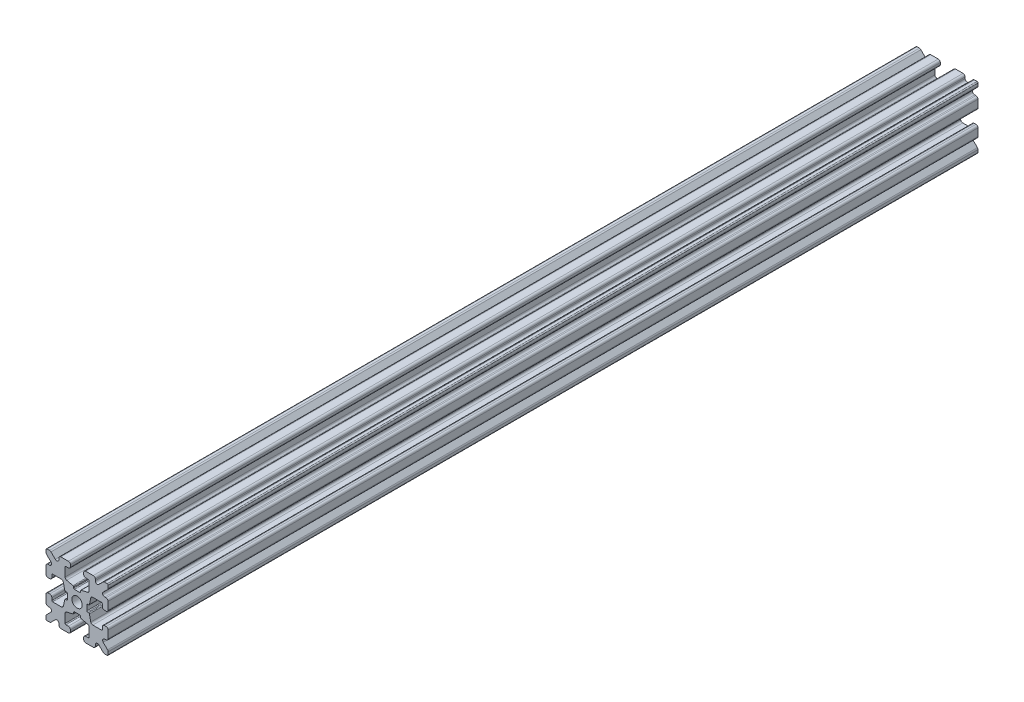
from build123d import *

# Parameters (mm, degrees)
SKETCH1_R           = 1.25
BOSS_EXTRUDE1_DEPTH = 210


with BuildPart() as part:
    # Sketch1 → Boss-Extrude1 (new body)
    with BuildSketch(Plane.XY.offset(150)):
        with BuildLine():
            Line((0.981757709, -2.970049142), (2.509355729, -3.312441801))
            ThreePointArc((2.509355729, -3.312441801), (2.790306204, -3.487828881), (2.900000001, -3.80033659))
            Line((2.900000001, -3.80033659), (2.900000001, -5.9))
            ThreePointArc((2.900000001, -5.9), (2.841421357, -6.041421356), (2.700000001, -6.1))
            Line((2.700000001, -6.1), (2.1, -6.1))
            ThreePointArc((2.1, -6.1), (1.746446609, -6.246446609), (1.6, -6.6))
            Line((1.6, -6.6), (1.6, -7))
            ThreePointArc((1.6, -7), (1.746446609, -7.353553391), (2.1, -7.5))
            Line((2.1, -7.5), (3.9, -7.5))
            ThreePointArc((3.9, -7.5), (4.253553391, -7.353553391), (4.4, -7))
            Line((4.4, -7), (4.4, -6.667766953))
            ThreePointArc((4.4, -6.667766953), (4.708658284, -6.205827187), (5.253553391, -6.314213563))
            Line((5.253553391, -6.314213563), (6.292893218, -7.353553391))
            ThreePointArc((6.292893218, -7.353553391), (6.455104893, -7.461939766), (6.646446609, -7.5))
            Line((6.646446609, -7.5), (7.25, -7.5))
            ThreePointArc((7.25, -7.5), (7.426776695, -7.426776695), (7.5, -7.25))
            Line((7.5, -7.25), (7.5, -6.646446609))
            ThreePointArc((7.5, -6.646446609), (7.461939766, -6.455104893), (7.353553391, -6.292893218))
            Line((7.353553391, -6.292893218), (6.314213563, -5.253553391))
            ThreePointArc((6.314213563, -5.253553391), (6.205827187, -4.708658284), (6.667766953, -4.4))
            Line((6.667766953, -4.4), (7, -4.4))
            ThreePointArc((7, -4.4), (7.353553391, -4.253553391), (7.5, -3.9))
            Line((7.5, -3.9), (7.5, -2.1))
            ThreePointArc((7.5, -2.1), (7.353553391, -1.746446609), (7, -1.6))
            Line((7, -1.6), (6.6, -1.6))
            ThreePointArc((6.6, -1.6), (6.246446609, -1.746446609), (6.1, -2.1))
            Line((6.1, -2.1), (6.1, -2.7))
            ThreePointArc((6.1, -2.7), (6.041421356, -2.841421356), (5.9, -2.9))
            Line((5.9, -2.9), (3.800336589, -2.9))
            ThreePointArc((3.800336589, -2.9), (3.487828881, -2.790306203), (3.312441801, -2.509355728))
            Line((3.312441801, -2.509355728), (2.970049141, -0.981757708))
            ThreePointArc((2.970049141, -0.981757708), (2.899894309, -0.869377518), (2.774891226, -0.8255))
            Line((2.774891226, -0.8255), (2.5470646, -0.8255))
            ThreePointArc((2.5470646, -0.8255), (2.405643243, -0.766921356), (2.3470646, -0.6255))
            Line((2.3470646, -0.6255), (2.3470646, 0.6255))
            ThreePointArc((2.3470646, 0.6255), (2.405643243, 0.766921356), (2.5470646, 0.8255))
            Line((2.5470646, 0.8255), (2.774891226, 0.8255))
            ThreePointArc((2.774891226, 0.8255), (2.899894309, 0.869377518), (2.970049141, 0.981757708))
            Line((2.970049141, 0.981757708), (3.312441801, 2.509355728))
            ThreePointArc((3.312441801, 2.509355728), (3.487828881, 2.790306203), (3.800336589, 2.9))
            Line((3.800336589, 2.9), (5.9, 2.9))
            ThreePointArc((5.9, 2.9), (6.041421356, 2.841421356), (6.1, 2.7))
            Line((6.1, 2.7), (6.1, 2.1))
            ThreePointArc((6.1, 2.1), (6.246446609, 1.746446609), (6.6, 1.6))
            Line((6.6, 1.6), (7, 1.6))
            ThreePointArc((7, 1.6), (7.353553391, 1.746446609), (7.5, 2.1))
            Line((7.5, 2.1), (7.5, 3.9))
            ThreePointArc((7.5, 3.9), (7.353553391, 4.253553391), (7, 4.4))
            Line((7, 4.4), (6.667766953, 4.4))
            ThreePointArc((6.667766953, 4.4), (6.205827187, 4.708658284), (6.314213563, 5.253553391))
            Line((6.314213563, 5.253553391), (7.353553391, 6.292893218))
            ThreePointArc((7.353553391, 6.292893218), (7.461939766, 6.455104893), (7.5, 6.646446609))
            Line((7.5, 6.646446609), (7.5, 7.25))
            ThreePointArc((7.5, 7.25), (7.426776695, 7.426776695), (7.25, 7.5))
            Line((7.25, 7.5), (6.646446609, 7.5))
            ThreePointArc((6.646446609, 7.5), (6.455104893, 7.461939766), (6.292893218, 7.353553391))
            Line((6.292893218, 7.353553391), (5.253553391, 6.314213563))
            ThreePointArc((5.253553391, 6.314213563), (4.708658284, 6.205827187), (4.4, 6.667766954))
            Line((4.4, 6.667766954), (4.4, 7))
            ThreePointArc((4.4, 7), (4.253553391, 7.353553391), (3.9, 7.5))
            Line((3.9, 7.5), (2.1, 7.5))
            ThreePointArc((2.1, 7.5), (1.746446609, 7.353553391), (1.6, 7))
            Line((1.6, 7), (1.6, 6.6))
            ThreePointArc((1.6, 6.6), (1.746446609, 6.246446609), (2.1, 6.1))
            Line((2.1, 6.1), (2.700000001, 6.1))
            ThreePointArc((2.700000001, 6.1), (2.841421357, 6.041421356), (2.900000001, 5.9))
            Line((2.900000001, 5.9), (2.900000001, 3.800336589))
            ThreePointArc((2.900000001, 3.800336589), (2.790306204, 3.487828881), (2.509355729, 3.312441801))
            Line((2.509355729, 3.312441801), (0.981757709, 2.970049141))
            ThreePointArc((0.981757709, 2.970049141), (0.869377519, 2.899894309), (0.8255, 2.774891226))
            Line((0.8255, 2.774891226), (0.8255, 2.5470646))
            ThreePointArc((0.8255, 2.5470646), (0.766921357, 2.405643243), (0.6255, 2.3470646))
            Line((0.6255, 2.3470646), (-0.6255, 2.3470646))
            ThreePointArc((-0.6255, 2.3470646), (-0.766921356, 2.405643243), (-0.8255, 2.5470646))
            Line((-0.8255, 2.5470646), (-0.8255, 2.774891226))
            ThreePointArc((-0.8255, 2.774891226), (-0.869377518, 2.89989431), (-0.981757708, 2.970049142))
            Line((-0.981757708, 2.970049142), (-2.509355728, 3.312441801))
            ThreePointArc((-2.509355728, 3.312441801), (-2.790306203, 3.487828881), (-2.9, 3.80033659))
            Line((-2.9, 3.80033659), (-2.9, 5.9))
            ThreePointArc((-2.9, 5.9), (-2.841421356, 6.041421356), (-2.7, 6.1))
            Line((-2.7, 6.1), (-2.1, 6.1))
            ThreePointArc((-2.1, 6.1), (-1.746446609, 6.246446609), (-1.6, 6.6))
            Line((-1.6, 6.6), (-1.6, 7))
            ThreePointArc((-1.6, 7), (-1.746446609, 7.353553391), (-2.1, 7.5))
            Line((-2.1, 7.5), (-3.9, 7.5))
            ThreePointArc((-3.9, 7.5), (-4.25355339, 7.353553391), (-4.4, 7))
            Line((-4.4, 7), (-4.4, 6.667766953))
            ThreePointArc((-4.4, 6.667766953), (-4.708658283, 6.205827187), (-5.25355339, 6.314213563))
            Line((-5.25355339, 6.314213563), (-6.292893218, 7.353553391))
            ThreePointArc((-6.292893218, 7.353553391), (-6.455104893, 7.461939766), (-6.646446609, 7.5))
            Line((-6.646446609, 7.5), (-7.25, 7.5))
            ThreePointArc((-7.25, 7.5), (-7.426776695, 7.426776695), (-7.5, 7.25))
            Line((-7.5, 7.25), (-7.5, 6.646446609))
            ThreePointArc((-7.5, 6.646446609), (-7.461939766, 6.455104893), (-7.353553391, 6.292893218))
            Line((-7.353553391, 6.292893218), (-6.314213563, 5.253553391))
            ThreePointArc((-6.314213563, 5.253553391), (-6.205827187, 4.708658284), (-6.667766953, 4.4))
            Line((-6.667766953, 4.4), (-7, 4.4))
            ThreePointArc((-7, 4.4), (-7.353553391, 4.253553391), (-7.5, 3.9))
            Line((-7.5, 3.9), (-7.5, 2.1))
            ThreePointArc((-7.5, 2.1), (-7.353553391, 1.746446609), (-7, 1.6))
            Line((-7, 1.6), (-6.6, 1.6))
            ThreePointArc((-6.6, 1.6), (-6.246446609, 1.746446609), (-6.1, 2.1))
            Line((-6.1, 2.1), (-6.1, 2.7))
            ThreePointArc((-6.1, 2.7), (-6.041421356, 2.841421356), (-5.9, 2.9))
            Line((-5.9, 2.9), (-3.80033659, 2.9))
            ThreePointArc((-3.80033659, 2.9), (-3.487828881, 2.790306203), (-3.312441801, 2.509355728))
            Line((-3.312441801, 2.509355728), (-2.970049142, 0.981757708))
            ThreePointArc((-2.970049142, 0.981757708), (-2.89989431, 0.869377518), (-2.774891226, 0.8255))
            Line((-2.774891226, 0.8255), (-2.5470646, 0.8255))
            ThreePointArc((-2.5470646, 0.8255), (-2.405643244, 0.766921356), (-2.3470646, 0.6255))
            Line((-2.3470646, 0.6255), (-2.3470646, -0.6255))
            ThreePointArc((-2.3470646, -0.6255), (-2.405643244, -0.766921356), (-2.5470646, -0.8255))
            Line((-2.5470646, -0.8255), (-2.774891226, -0.8255))
            ThreePointArc((-2.774891226, -0.8255), (-2.89989431, -0.869377518), (-2.970049142, -0.981757708))
            Line((-2.970049142, -0.981757708), (-3.312441801, -2.509355728))
            ThreePointArc((-3.312441801, -2.509355728), (-3.487828881, -2.790306203), (-3.80033659, -2.9))
            Line((-3.80033659, -2.9), (-5.9, -2.9))
            ThreePointArc((-5.9, -2.9), (-6.041421356, -2.841421356), (-6.1, -2.7))
            Line((-6.1, -2.7), (-6.1, -2.1))
            ThreePointArc((-6.1, -2.1), (-6.246446609, -1.746446609), (-6.6, -1.6))
            Line((-6.6, -1.6), (-7, -1.6))
            ThreePointArc((-7, -1.6), (-7.353553391, -1.746446609), (-7.5, -2.1))
            Line((-7.5, -2.1), (-7.5, -3.9))
            ThreePointArc((-7.5, -3.9), (-7.353553391, -4.253553391), (-7, -4.4))
            Line((-7, -4.4), (-6.667766953, -4.4))
            ThreePointArc((-6.667766953, -4.4), (-6.205827187, -4.708658284), (-6.314213563, -5.253553391))
            Line((-6.314213563, -5.253553391), (-7.353553391, -6.292893218))
            ThreePointArc((-7.353553391, -6.292893218), (-7.461939766, -6.455104893), (-7.5, -6.646446609))
            Line((-7.5, -6.646446609), (-7.5, -7.25))
            ThreePointArc((-7.5, -7.25), (-7.426776695, -7.426776695), (-7.25, -7.5))
            Line((-7.25, -7.5), (-6.646446609, -7.5))
            ThreePointArc((-6.646446609, -7.5), (-6.455104893, -7.461939766), (-6.292893218, -7.353553391))
            Line((-6.292893218, -7.353553391), (-5.25355339, -6.314213563))
            ThreePointArc((-5.25355339, -6.314213563), (-4.708658284, -6.205827187), (-4.4, -6.667766953))
            Line((-4.4, -6.667766953), (-4.4, -7))
            ThreePointArc((-4.4, -7), (-4.25355339, -7.353553391), (-3.9, -7.5))
            Line((-3.9, -7.5), (-2.1, -7.5))
            ThreePointArc((-2.1, -7.5), (-1.746446609, -7.353553391), (-1.6, -7))
            Line((-1.6, -7), (-1.6, -6.6))
            ThreePointArc((-1.6, -6.6), (-1.746446609, -6.246446609), (-2.1, -6.1))
            Line((-2.1, -6.1), (-2.7, -6.1))
            ThreePointArc((-2.7, -6.1), (-2.841421356, -6.041421356), (-2.9, -5.9))
            Line((-2.9, -5.9), (-2.9, -3.80033659))
            ThreePointArc((-2.9, -3.80033659), (-2.790306203, -3.487828881), (-2.509355728, -3.312441801))
            Line((-2.509355728, -3.312441801), (-0.981757708, -2.970049142))
            ThreePointArc((-0.981757708, -2.970049142), (-0.869377518, -2.89989431), (-0.8255, -2.774891226))
            Line((-0.8255, -2.774891226), (-0.8255, -2.5470646))
            ThreePointArc((-0.8255, -2.5470646), (-0.766921356, -2.405643244), (-0.6255, -2.3470646))
            Line((-0.6255, -2.3470646), (0.6255, -2.3470646))
            ThreePointArc((0.6255, -2.3470646), (0.766921357, -2.405643244), (0.8255, -2.5470646))
            Line((0.8255, -2.5470646), (0.8255, -2.774891226))
            ThreePointArc((0.8255, -2.774891226), (0.869377519, -2.89989431), (0.981757709, -2.970049142))
        make_face()
        with Locations(Location((0, 0, 0), (0, 0, 180))):
            Circle(SKETCH1_R, mode=Mode.SUBTRACT)
    extrude(amount=-BOSS_EXTRUDE1_DEPTH)


solid = part.part
